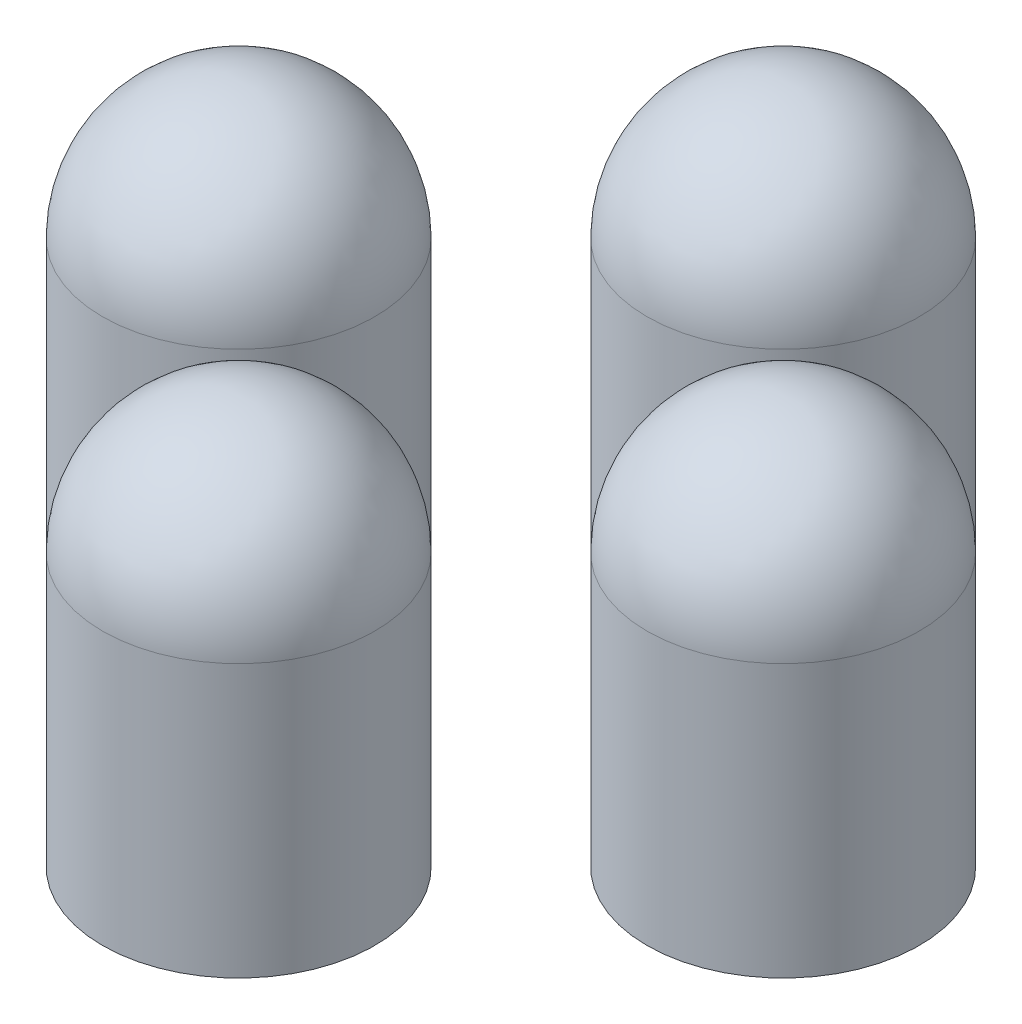
from build123d import *

# Parameters (mm, degrees)
SKETCH1_R             = 5
BOSS_EXTRUDE1_DEPTH   = 10
BOSS_EXTRUDE1_2_DEPTH = 10
BOSS_EXTRUDE1_3_DEPTH = 10
BOSS_EXTRUDE1_4_DEPTH = 10
DOME4_FACE_RADIUS     = 5
DOME4_HEIGHT          = 5
DOME5_FACE_RADIUS     = 5
DOME5_HEIGHT          = 5
DOME6_FACE_RADIUS     = 5
DOME6_HEIGHT          = 5
DOME7_FACE_RADIUS     = 5
DOME7_HEIGHT          = 5


with BuildPart() as part:
    # Sketch1 → Boss-Extrude1 (new body)
    with BuildSketch(Plane(origin=(0, 0, 0), x_dir=(1, 0, 0), z_dir=(0, 1, 0))):
        with Locations(Location((0, 0, 0), (0, 0, 270))):
            Circle(SKETCH1_R)
    extrude(amount=BOSS_EXTRUDE1_DEPTH)

    # Dome4: a dome of height H over a round flat face of radius A is a cap of a sphere of radius (A * A + H * H) / (2 * H)
    dome4_r = (DOME4_FACE_RADIUS * DOME4_FACE_RADIUS + DOME4_HEIGHT * DOME4_HEIGHT) / (2 * DOME4_HEIGHT)
    dome4_base = Plane((0, 10, 0), z_dir=(0, 1, 0))
    with Locations(dome4_base.offset(DOME4_HEIGHT - dome4_r)):
        dome4_ball = Sphere(dome4_r, mode=Mode.PRIVATE)
    add(split(dome4_ball, bisect_by=dome4_base, keep=Keep.TOP, mode=Mode.PRIVATE))


with BuildPart() as body_2:
    # Sketch1 → Boss-Extrude1 2 (new body)
    with BuildSketch(Plane(origin=(0, 0, 0), x_dir=(1, 0, 0), z_dir=(0, 1, 0))):
        with Locations(Location((10, 10, 0), (0, 0, 270))):
            Circle(SKETCH1_R)
    extrude(amount=BOSS_EXTRUDE1_2_DEPTH)

    # Dome5: a dome of height H over a round flat face of radius A is a cap of a sphere of radius (A * A + H * H) / (2 * H)
    dome5_r = (DOME5_FACE_RADIUS * DOME5_FACE_RADIUS + DOME5_HEIGHT * DOME5_HEIGHT) / (2 * DOME5_HEIGHT)
    dome5_base = Plane((10, 10, -10), z_dir=(0, 1, 0))
    with Locations(dome5_base.offset(DOME5_HEIGHT - dome5_r)):
        dome5_ball = Sphere(dome5_r, mode=Mode.PRIVATE)
    add(split(dome5_ball, bisect_by=dome5_base, keep=Keep.TOP, mode=Mode.PRIVATE))


with BuildPart() as body_3:
    # Sketch1 → Boss-Extrude1 3 (new body)
    with BuildSketch(Plane(origin=(0, 0, 0), x_dir=(1, 0, 0), z_dir=(0, 1, 0))):
        with Locations(Location((20, 0, 0), (0, 0, 270))):
            Circle(SKETCH1_R)
    extrude(amount=BOSS_EXTRUDE1_3_DEPTH)

    # Dome6: a dome of height H over a round flat face of radius A is a cap of a sphere of radius (A * A + H * H) / (2 * H)
    dome6_r = (DOME6_FACE_RADIUS * DOME6_FACE_RADIUS + DOME6_HEIGHT * DOME6_HEIGHT) / (2 * DOME6_HEIGHT)
    dome6_base = Plane((20, 10, 0), z_dir=(0, 1, 0))
    with Locations(dome6_base.offset(DOME6_HEIGHT - dome6_r)):
        dome6_ball = Sphere(dome6_r, mode=Mode.PRIVATE)
    add(split(dome6_ball, bisect_by=dome6_base, keep=Keep.TOP, mode=Mode.PRIVATE))


with BuildPart() as body_4:
    # Sketch1 → Boss-Extrude1 4 (new body)
    with BuildSketch(Plane(origin=(0, 0, 0), x_dir=(1, 0, 0), z_dir=(0, 1, 0))):
        with Locations(Location((10, -10, 0), (0, 0, 270))):
            Circle(SKETCH1_R)
    extrude(amount=BOSS_EXTRUDE1_4_DEPTH)

    # Dome7: a dome of height H over a round flat face of radius A is a cap of a sphere of radius (A * A + H * H) / (2 * H)
    dome7_r = (DOME7_FACE_RADIUS * DOME7_FACE_RADIUS + DOME7_HEIGHT * DOME7_HEIGHT) / (2 * DOME7_HEIGHT)
    dome7_base = Plane((10, 10, 10), z_dir=(0, 1, 0))
    with Locations(dome7_base.offset(DOME7_HEIGHT - dome7_r)):
        dome7_ball = Sphere(dome7_r, mode=Mode.PRIVATE)
    add(split(dome7_ball, bisect_by=dome7_base, keep=Keep.TOP, mode=Mode.PRIVATE))


solid = Compound([part.part, body_2.part, body_3.part, body_4.part])
